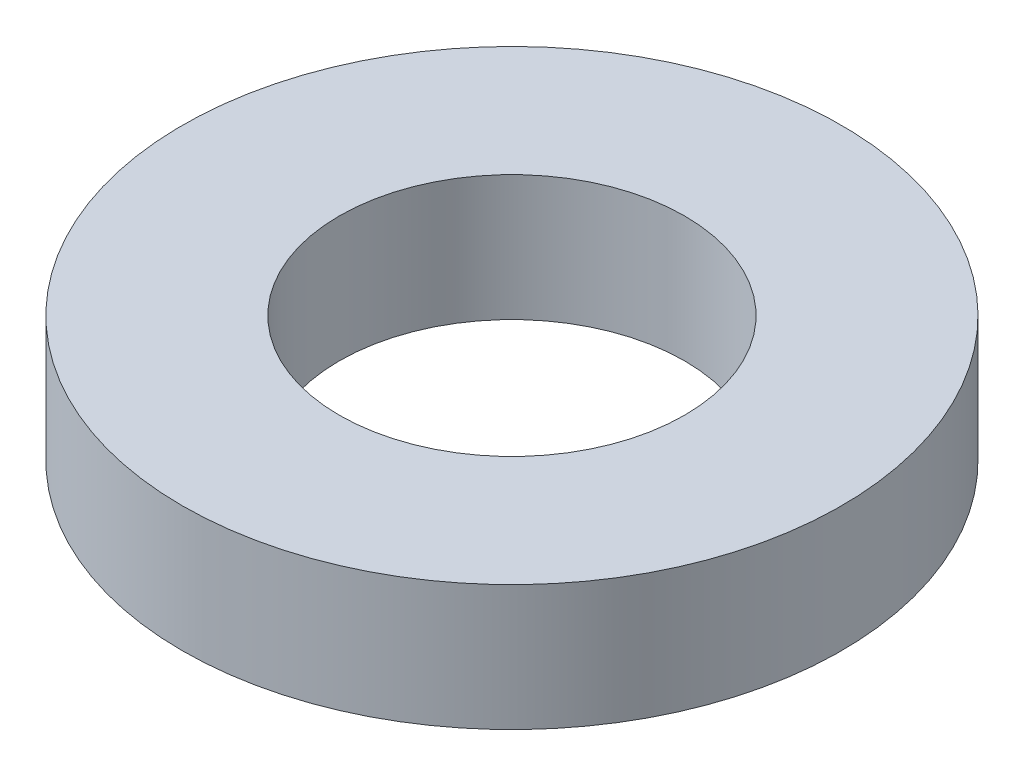
from build123d import *

# Parameters (mm, degrees)
SKETCH1_R           = 3.15
SKETCH1_R_2         = 1.65
BOSS_EXTRUDE1_DEPTH = 1.2


with BuildPart() as part:
    # Sketch1 → Boss-Extrude1 (new body)
    with BuildSketch(Plane(origin=(0, 0, 0), x_dir=(1, 0, 0), z_dir=(0, 1, 0))):
        with Locations(Location((0, 0, 0), (0, 0, 270))):
            Circle(SKETCH1_R)
        with Locations(Location((0, 0, 0), (0, 0, 270))):
            Circle(SKETCH1_R_2, mode=Mode.SUBTRACT)
    extrude(amount=BOSS_EXTRUDE1_DEPTH)


solid = part.part
